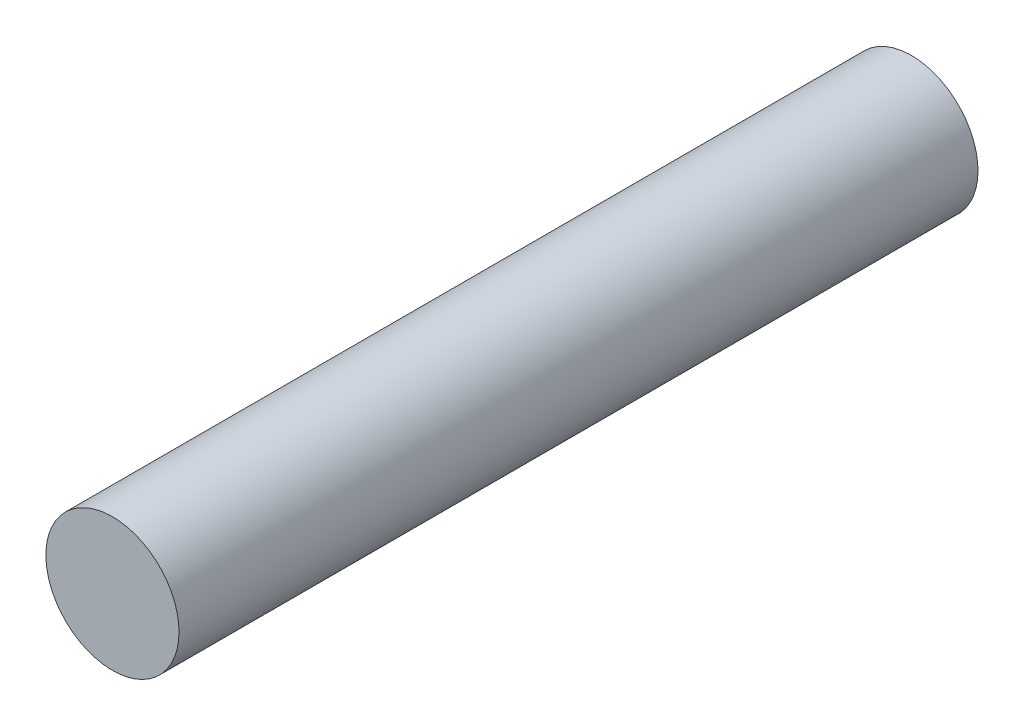
from build123d import *

# Parameters (mm, degrees)
SKETCH1_R           = 2
BOSS_EXTRUDE1_DEPTH = 24


with BuildPart() as part:
    # Sketch1 → Boss-Extrude1 (new body)
    with BuildSketch(Plane.XY):
        Circle(SKETCH1_R)
    extrude(amount=BOSS_EXTRUDE1_DEPTH)


solid = part.part
